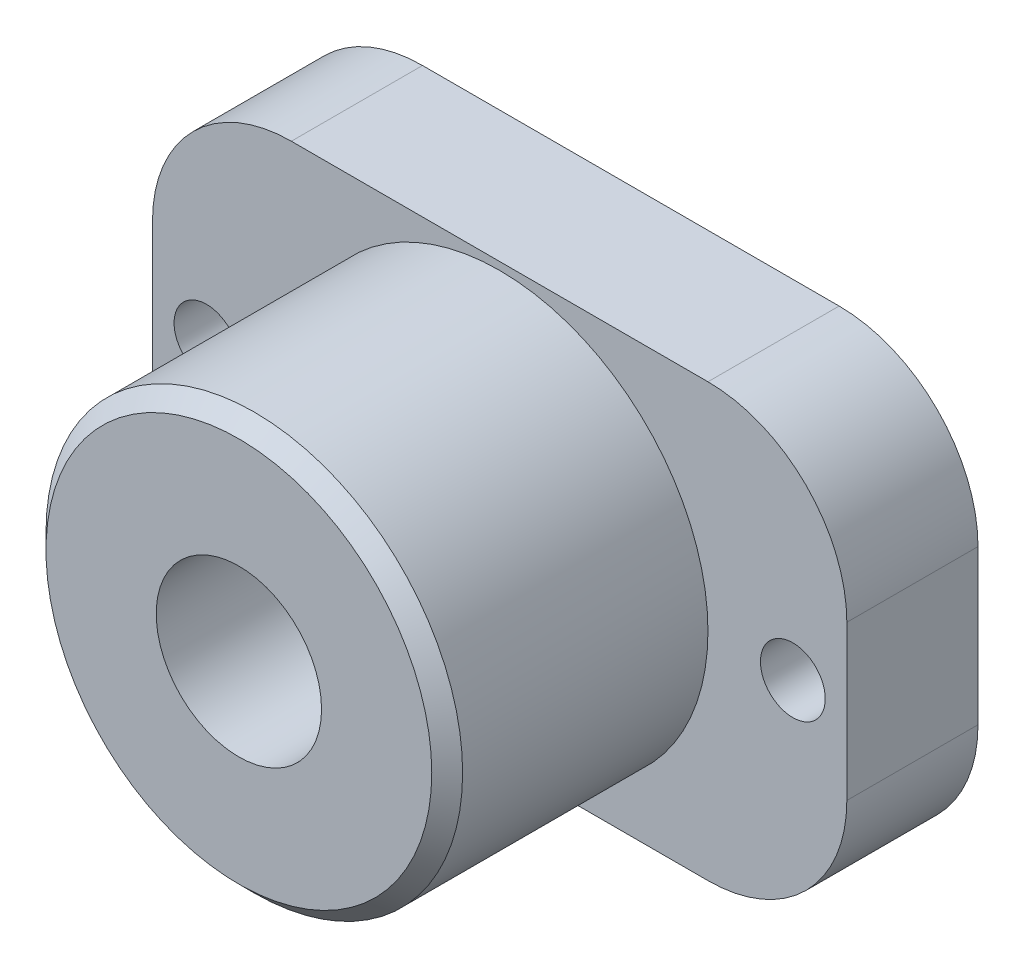
from build123d import *

# Parameters (mm, degrees)
F_1_2_13_TAPPED_HOLE1_D     = 10.71626
BOSS_EXTRUDE1_START         = -8.5
SKETCH9_W                   = 45
SKETCH9_H                   = 28
SKETCH9_R                   = 13.5
BOSS_EXTRUDE1_DEPTH         = 8.5
TAP_DRILL_FOR_M5X0_8_TAP1_D = 4.2
FILLET1_R                   = 9
CHAMFER1_SIZE               = 1
SKETCH8_R                   = 11.5
CUT_EXTRUDE2_DEPTH          = 12


with BuildPart() as part:
    # Sketch2 → Revolve1 (revolve)
    with BuildSketch(Plane(origin=(0, 0, 0), x_dir=(0, 0, -1), z_dir=(1, 0, 0)), mode=Mode.PRIVATE) as revolve1_sk:
        Polygon((0, 13.5), (16.9, 13.5), (16.9, 14), (25.4, 14), (25.4, 0), (0, 0), align=None)
    revolve(revolve1_sk.sketch.rotate(Axis((0, 0, 0), (0, 0, 1)), 90), axis=Axis((0, 0, 0), (0, 0, 1)))

    # 1/2-13 Tapped Hole1 (through all)
    with Locations(Plane.XY):
        with Locations((0, 0)):
            Hole(F_1_2_13_TAPPED_HOLE1_D / 2)

    # Sketch9 → Boss-Extrude1 (add)
    with BuildSketch(Plane.XY.offset(-16.9).offset(BOSS_EXTRUDE1_START)):
        Rectangle(SKETCH9_W, SKETCH9_H)
        with Locations(Location((0, 0, 0), (0, 0, 180))):
            Circle(SKETCH9_R, mode=Mode.SUBTRACT)
    extrude(amount=BOSS_EXTRUDE1_DEPTH)

    # Tap Drill for M5x0.8 Tap1 (through all)
    with Locations(Plane.XY.offset(-16.9)):
        with Locations((-19, 0), (19, 0)):
            Hole(TAP_DRILL_FOR_M5X0_8_TAP1_D / 2)

    # Fillet1
    fillet1_edges = [part.edges().sort_by_distance(p)[0] for p in [
        (-22.5, 14, -21.15),
        (22.5, -14, -21.15),
        (-22.5, -14, -21.15),
        (22.5, 14, -21.15),
    ]]
    fillet(fillet1_edges, radius=FILLET1_R)

    # Chamfer1
    chamfer1_edges = [part.edges().sort_by_distance(p)[0] for p in [
        (13.5, 0, 0),
    ]]
    chamfer(chamfer1_edges, length=CHAMFER1_SIZE)

    # Sketch8 → Cut-Extrude2 (cut)
    with BuildSketch(Plane(origin=(0, 0, -25.4), x_dir=(-1, 0, 0), z_dir=(0, 0, -1))):
        Circle(SKETCH8_R)
    extrude(amount=-CUT_EXTRUDE2_DEPTH, mode=Mode.SUBTRACT)


solid = part.part
